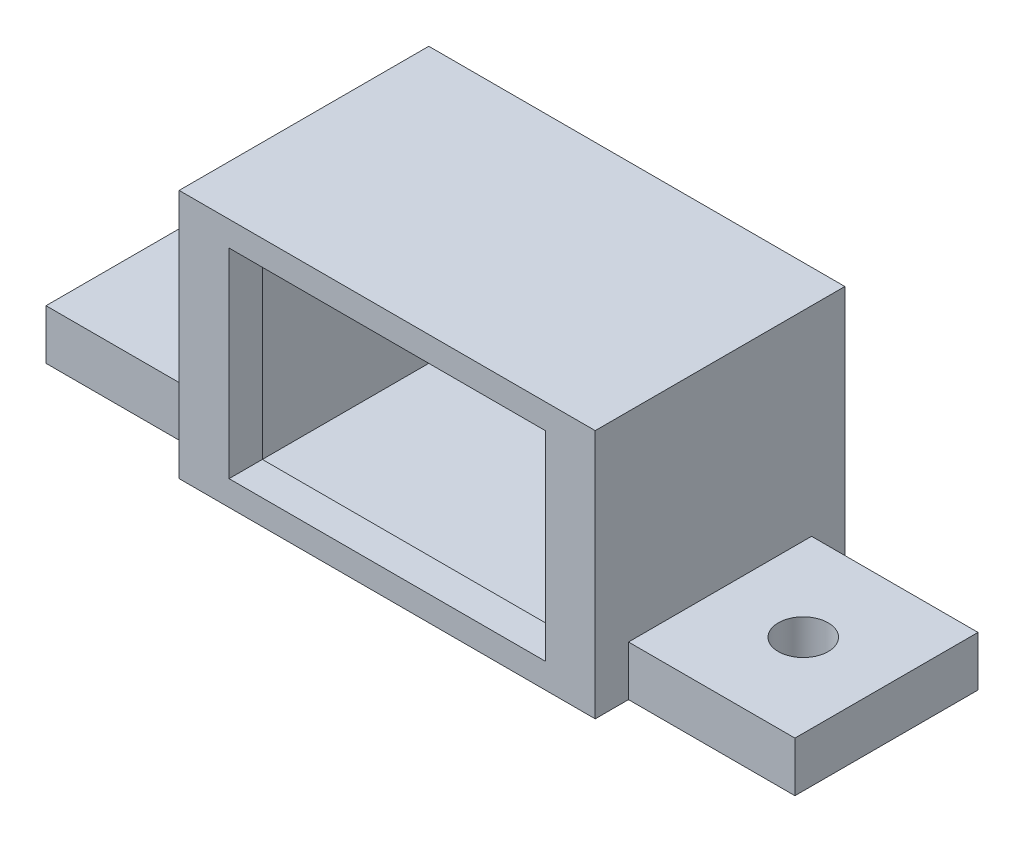
from build123d import *

# Parameters (mm, degrees)
SKETCH1_W           = 25
SKETCH1_H           = 15
BOSS_EXTRUDE1_DEPTH = 15
SKETCH2_W           = 20
SKETCH2_H           = 13
CUT_EXTRUDE1_DEPTH  = 13
SKETCH3_W           = 19
SKETCH3_H           = 12
CUT_EXTRUDE2_DEPTH  = 33.787192622
SKETCH10_W          = 11
SKETCH10_H          = 3
BOSS_EXTRUDE5_DEPTH = 10
SKETCH11_R          = 1.5
CUT_EXTRUDE4_DEPTH  = 32.527765541
SKETCH13_W          = 11
SKETCH13_H          = 3
BOSS_EXTRUDE6_DEPTH = 10
SKETCH14_R          = 1.5
CUT_EXTRUDE5_DEPTH  = 40.924929555


with BuildPart() as part:
    # Sketch1 → Boss-Extrude1 (new body)
    with BuildSketch(Plane.XY):
        with Locations((12.5, -7.5)):
            Rectangle(SKETCH1_W, SKETCH1_H)
    extrude(amount=BOSS_EXTRUDE1_DEPTH)

    # Sketch2 → Cut-Extrude1 (cut)
    with BuildSketch(Plane(origin=(0, 0, 0), x_dir=(-1, 0, 0), z_dir=(0, 0, -1))):
        with Locations((-12.5, -7.5)):
            Rectangle(SKETCH2_W, SKETCH2_H)
    extrude(amount=-CUT_EXTRUDE1_DEPTH, mode=Mode.SUBTRACT)

    # Sketch3 → Cut-Extrude2 (cut, through all)
    with BuildSketch(Plane.XY.offset(15)):
        with Locations((12.5, -7.5)):
            Rectangle(SKETCH3_W, SKETCH3_H)
    extrude(amount=-CUT_EXTRUDE2_DEPTH, mode=Mode.SUBTRACT)

    # Sketch10 → Boss-Extrude5 (add)
    with BuildSketch(Plane.ZY):
        with Locations((7.5, -13.5)):
            Rectangle(SKETCH10_W, SKETCH10_H)
    extrude(amount=BOSS_EXTRUDE5_DEPTH)

    # Sketch11 → Cut-Extrude4 (cut, through all)
    with BuildSketch(Plane(origin=(0, -12, 0), x_dir=(1, 0, 0), z_dir=(0, 1, 0))):
        with Locations(Location((-5, -7.5, 0), (0, 0, 180))):
            Circle(SKETCH11_R)
    extrude(amount=-CUT_EXTRUDE4_DEPTH, mode=Mode.SUBTRACT)

    # Sketch13 → Boss-Extrude6 (add)
    with BuildSketch(Plane(origin=(25, 0, 0), x_dir=(0, 0, -1), z_dir=(1, 0, 0))):
        with Locations((-7.5, -13.5)):
            Rectangle(SKETCH13_W, SKETCH13_H)
    extrude(amount=BOSS_EXTRUDE6_DEPTH)

    # Sketch14 → Cut-Extrude5 (cut, through all)
    with BuildSketch(Plane(origin=(0, -12, 0), x_dir=(1, 0, 0), z_dir=(0, 1, 0))):
        with Locations(Location((30, -7.5, 0), (0, 0, 180))):
            Circle(SKETCH14_R)
    extrude(amount=-CUT_EXTRUDE5_DEPTH, mode=Mode.SUBTRACT)


solid = part.part
